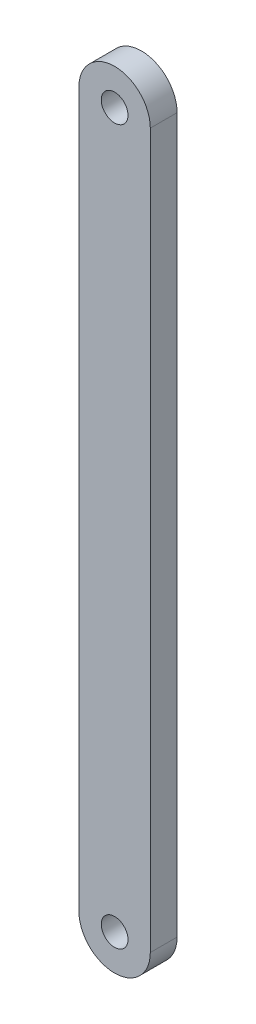
from build123d import *

# Parameters (mm, degrees)
SKETCH_1_R      = 1.5
EXTRUDE_1_DEPTH = 3


with BuildPart() as part:
    # 草圖1 → 填料-伸長1 (new body)
    with BuildSketch(Plane.XY):
        with BuildLine():
            add(Edge.make_bspline(
                [(40.300099998, 5.000000006), (40.300100002, 2.65683103), (38.643218977, 0.999970711), (36.300050001, 0.999999999), (33.956881026, 1.000029287), (32.30004142, 2.656931025), (32.3001, 5.0001)],
                knots=[0, 0, 0, 0, 0.5, 0.5, 0.5, 1, 1, 1, 1], degree=3, weights=[1, 0.804734908, 0.804734908, 1, 0.804734908, 0.804734908, 1]))
            Line((32.3001, 5.0001), (32.3001, 85.0001))
            ThreePointArc((32.3001, 85.0001), (36.30015, 89.000000001), (40.3001, 85))
            Line((40.3001, 85), (40.300099998, 5.000000006))
        make_face()
        with Locations((36.300099998, 4.999999998)):
            Circle(SKETCH_1_R, mode=Mode.SUBTRACT)
        with Locations((36.3001, 85)):
            Circle(SKETCH_1_R, mode=Mode.SUBTRACT)
    extrude(amount=EXTRUDE_1_DEPTH)


solid = part.part
